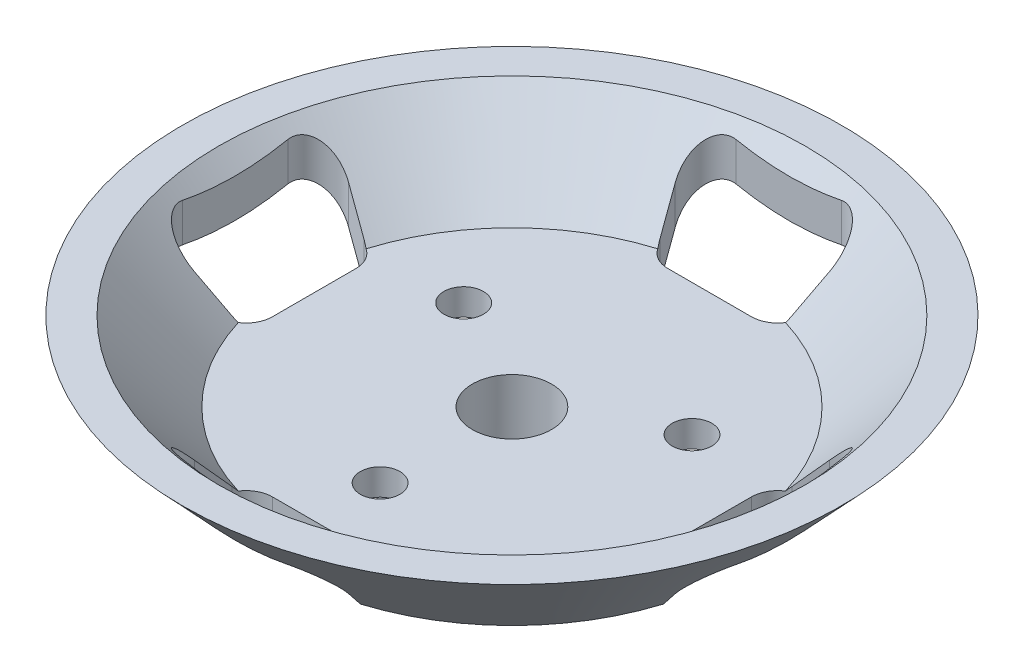
from build123d import *

# Parameters (mm, degrees)
SKETCH1_R           = 17.5
SKETCH2_R           = 25
SHELL1_T            = -2
SKETCH3_R           = 7.25
SKETCH3_R_2         = 3
BOSS_EXTRUDE1_DEPTH = 5
CUT_EXTRUDE1_START  = -5
SKETCH4_R           = 3
CUT_EXTRUDE1_DEPTH  = 5
SKETCH5_R           = 1.5
CUT_EXTRUDE2_DEPTH  = 37.249138081
CUT_EXTRUDE3_DEPTH  = 15


with BuildPart() as part:
    # Sketch1 → Loft1 section 0
    with BuildSketch(Plane(origin=(0, 0, 0), x_dir=(1, 0, 0), z_dir=(0, 1, 0))):
        Circle(SKETCH1_R)
    # Sketch2 → Loft1 section 1
    with BuildSketch(Plane(origin=(0, 8, 0), x_dir=(1, 0, 0), z_dir=(0, 1, 0))):
        Circle(SKETCH2_R)
    loft()

    # Shell1
    shell1_openings = [part.faces().sort_by_distance(p)[0] for p in [
        (0, 8, 0),
    ]]
    offset(amount=SHELL1_T, openings=shell1_openings, kind=Kind.INTERSECTION)

    # Sketch3 → Boss-Extrude1 (add)
    with BuildSketch(Plane.XZ):
        with Locations(Location((0, 0, 0), (0, 0, 90))):
            Circle(SKETCH3_R)
        with Locations(Location((0, 0, 0), (0, 0, 270))):
            Circle(SKETCH3_R_2, mode=Mode.SUBTRACT)
    extrude(amount=BOSS_EXTRUDE1_DEPTH)

    # Sketch4 → Cut-Extrude1 (cut)
    with BuildSketch(Plane.XZ.offset(CUT_EXTRUDE1_START)):
        with Locations(Location((0, 0, 0), (0, 0, 90))):
            Circle(SKETCH4_R)
    extrude(amount=CUT_EXTRUDE1_DEPTH, mode=Mode.SUBTRACT)

    # Sketch5 → Cut-Extrude2 (cut, through all)
    with BuildSketch(Plane.XZ):
        with Locations(Location((0, 10, 0), (0, 0, 270))):
            Circle(SKETCH5_R)
        with Locations(Location((8.660254038, -5, 0), (0, 0, 270))):
            Circle(SKETCH5_R)
        with Locations(Location((-8.660254038, -5, 0), (0, 0, 270))):
            Circle(SKETCH5_R)
    extrude(amount=-CUT_EXTRUDE2_DEPTH, mode=Mode.SUBTRACT)

    # Sketch6 → Cut-Extrude3 (cut)
    with BuildSketch(Plane.XZ.offset(5)):
        with BuildLine():
            Line((-5.012820513, 16.230769231), (-5.846153846, 18.230769231))
            ThreePointArc((-5.846153846, 18.230769231), (-5.664100589, 20.109400392), (-4, 21))
            Line((-4, 21), (4, 21))
            ThreePointArc((4, 21), (5.664100589, 20.109400392), (5.846153846, 18.230769231))
            Line((5.846153846, 18.230769231), (5.012820513, 16.230769231))
            ThreePointArc((5.012820513, 16.230769231), (4.276067059, 15.335899411), (3.166666667, 15))
            Line((3.166666667, 15), (-3.166666667, 15))
            ThreePointArc((-3.166666667, 15), (-4.276067059, 15.335899411), (-5.012820513, 16.230769231))
        make_face()
        with BuildLine():
            Line((15, -3.166666667), (15, 3.166666667))
            ThreePointArc((15, 3.166666667), (15.335899411, 4.276067059), (16.230769231, 5.012820513))
            Line((16.230769231, 5.012820513), (18.230769231, 5.846153846))
            ThreePointArc((18.230769231, 5.846153846), (20.109400392, 5.664100589), (21, 4))
            Line((21, 4), (21, -4))
            ThreePointArc((21, -4), (20.109400392, -5.664100589), (18.230769231, -5.846153846))
            Line((18.230769231, -5.846153846), (16.230769231, -5.012820513))
            ThreePointArc((16.230769231, -5.012820513), (15.335899411, -4.276067059), (15, -3.166666667))
        make_face()
        with BuildLine():
            Line((-3.166666667, -15), (3.166666667, -15))
            ThreePointArc((3.166666667, -15), (4.276067059, -15.335899411), (5.012820513, -16.230769231))
            Line((5.012820513, -16.230769231), (5.846153846, -18.230769231))
            ThreePointArc((5.846153846, -18.230769231), (5.664100589, -20.109400392), (4, -21))
            Line((4, -21), (-4, -21))
            ThreePointArc((-4, -21), (-5.664100589, -20.109400392), (-5.846153846, -18.230769231))
            Line((-5.846153846, -18.230769231), (-5.012820513, -16.230769231))
            ThreePointArc((-5.012820513, -16.230769231), (-4.276067059, -15.335899411), (-3.166666667, -15))
        make_face()
        with BuildLine():
            Line((-15, 3.166666667), (-15, -3.166666667))
            ThreePointArc((-15, -3.166666667), (-15.335899411, -4.276067059), (-16.230769231, -5.012820513))
            Line((-16.230769231, -5.012820513), (-18.230769231, -5.846153846))
            ThreePointArc((-18.230769231, -5.846153846), (-20.109400392, -5.664100589), (-21, -4))
            Line((-21, -4), (-21, 4))
            ThreePointArc((-21, 4), (-20.109400392, 5.664100589), (-18.230769231, 5.846153846))
            Line((-18.230769231, 5.846153846), (-16.230769231, 5.012820513))
            ThreePointArc((-16.230769231, 5.012820513), (-15.335899411, 4.276067059), (-15, 3.166666667))
        make_face()
    extrude(amount=-CUT_EXTRUDE3_DEPTH, mode=Mode.SUBTRACT)


solid = part.part
